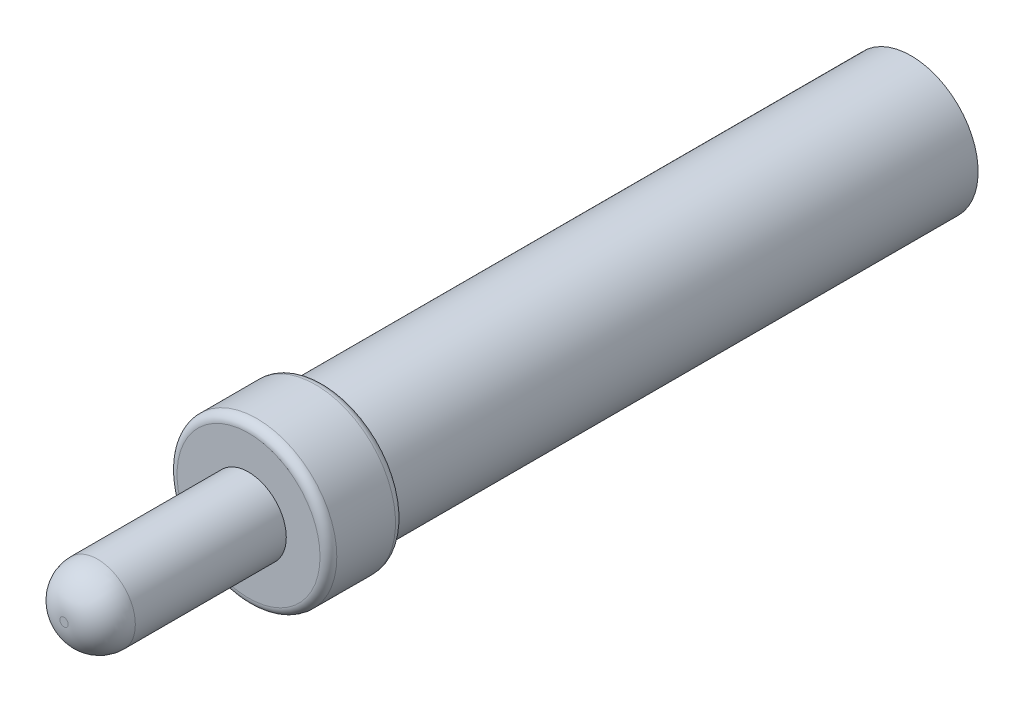
from build123d import *

# Parameters (mm, degrees)
ESBO_O1_R                     = 4.7625
RESSALTO_EXTRUS_O1_DEPTH      = 50.5
FURO_ROSCADO_DE_M3X0_52_D     = 2.5
FURO_ROSCADO_DE_M3X0_52_DEPTH = 8.5
FURO_ROSCADO_DE_M3X0_52_TIP   = 0.751075774
ESBO_O8_OUTSIDE_W             = 21.979
ESBO_O8_OUTSIDE_H             = 21.979
ESBO_O8_OUTSIDE_R             = 4
CORTE_EXTRUS_O1_DEPTH         = 35
ESBO_O10_OUTSIDE_W            = 21.979
ESBO_O10_OUTSIDE_H            = 21.979
ESBO_O10_OUTSIDE_R            = 2.25
CORTE_EXTRUS_O3_DEPTH         = 11
FILETE6_R                     = 2
FILETE5_R                     = 0.5


with BuildPart() as part:
    # Esboço1 → Ressalto-extrusão1 (new body)
    with BuildSketch(Plane.XY):
        with Locations((240.708388302, 2.596082859)):
            Circle(ESBO_O1_R)
    extrude(amount=RESSALTO_EXTRUS_O1_DEPTH)

    # Furo roscado de M3x0.52
    with Locations(Plane(origin=(0, 0, 0), x_dir=(-1, 0, 0), z_dir=(0, 0, -1))):
        with Locations((-240.708388302, 2.596082859)):
            Hole(FURO_ROSCADO_DE_M3X0_52_D / 2, depth=FURO_ROSCADO_DE_M3X0_52_DEPTH)
            with Locations((0, 0, -(FURO_ROSCADO_DE_M3X0_52_DEPTH + FURO_ROSCADO_DE_M3X0_52_TIP / 2))):  # 118° drill point
                Cone(0, FURO_ROSCADO_DE_M3X0_52_D / 2, FURO_ROSCADO_DE_M3X0_52_TIP, mode=Mode.SUBTRACT)

    # Esboço8 outside → Corte-extrusão1 (cut)
    with BuildSketch(Plane(origin=(0, 0, 0), x_dir=(-1, 0, 0), z_dir=(0, 0, -1))):
        with Locations((-240.7085, 2.5965)):
            Rectangle(ESBO_O8_OUTSIDE_W, ESBO_O8_OUTSIDE_H)
        with Locations((-240.708388302, 2.596082859)):
            Circle(ESBO_O8_OUTSIDE_R, mode=Mode.SUBTRACT)
    extrude(amount=-CORTE_EXTRUS_O1_DEPTH, mode=Mode.SUBTRACT)

    # Esboço10 outside → Corte-extrusão3 (cut)
    with BuildSketch(Plane.XY.offset(50.5)):
        with Locations((240.7085, 2.5965)):
            Rectangle(ESBO_O10_OUTSIDE_W, ESBO_O10_OUTSIDE_H)
        with Locations((240.708388302, 2.596082859)):
            Circle(ESBO_O10_OUTSIDE_R, mode=Mode.SUBTRACT)
    extrude(amount=-CORTE_EXTRUS_O3_DEPTH, mode=Mode.SUBTRACT)

    # Filete6
    filete6_edges = [part.edges().sort_by_distance(p)[0] for p in [
        (238.458388302, 2.596082859, 50.5),
    ]]
    fillet(filete6_edges, radius=FILETE6_R)

    # Filete5
    filete5_edges = [part.edges().sort_by_distance(p)[0] for p in [
        (235.945888302, 2.596082859, 35),
        (235.945888302, 2.596082859, 39.5),
    ]]
    fillet(filete5_edges, radius=FILETE5_R)


solid = part.part
